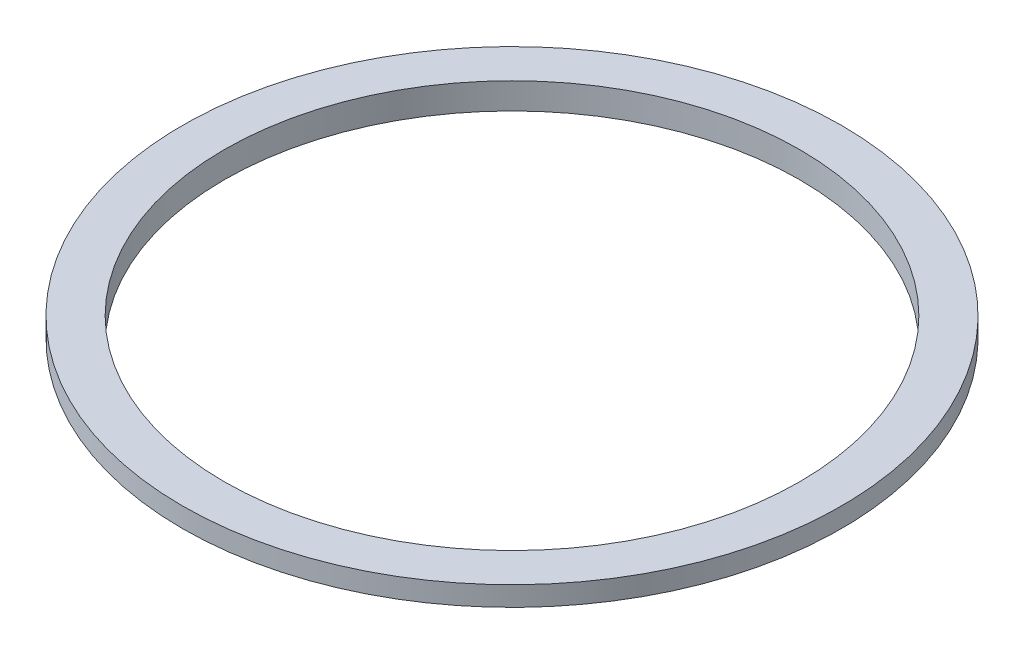
from build123d import *

# Parameters (mm, degrees)
SKETCH1_W = 5
SKETCH1_H = 5


with BuildPart() as part:
    # Sketch1 → Revolve1 (revolve)
    with BuildSketch(Plane.XY):
        with Locations((30, 0)):
            Rectangle(SKETCH1_W, SKETCH1_H)
        Polygon((29.375, -1.496320344), (27.878679656, 0), (29.375, 1.496320344), (29.375, 2.121320344), (30.625, 2.121320344), (30.625, 1.496320344), (32.121320344, 0), (30.625, -1.496320344), (30.625, -2.121320344), (29.375, -2.121320344), align=None, mode=Mode.SUBTRACT)
    revolve(axis=Axis((0, -28.665734922, 0), (0, 1, 0)))

    # Sketch2 → Cut-Revolve1 (revolve, cut)
    with BuildSketch(Plane.XY):
        Polygon((27.5, 0), (31.5, 0), (31.5, 2.5), (32.5, 2.5), (32.5, 0), (32.5, -2.5), (27.5, -2.5), align=None)
    revolve(axis=Axis((0, 0, 0), (0, 1, 0)), mode=Mode.SUBTRACT)


solid = part.part
